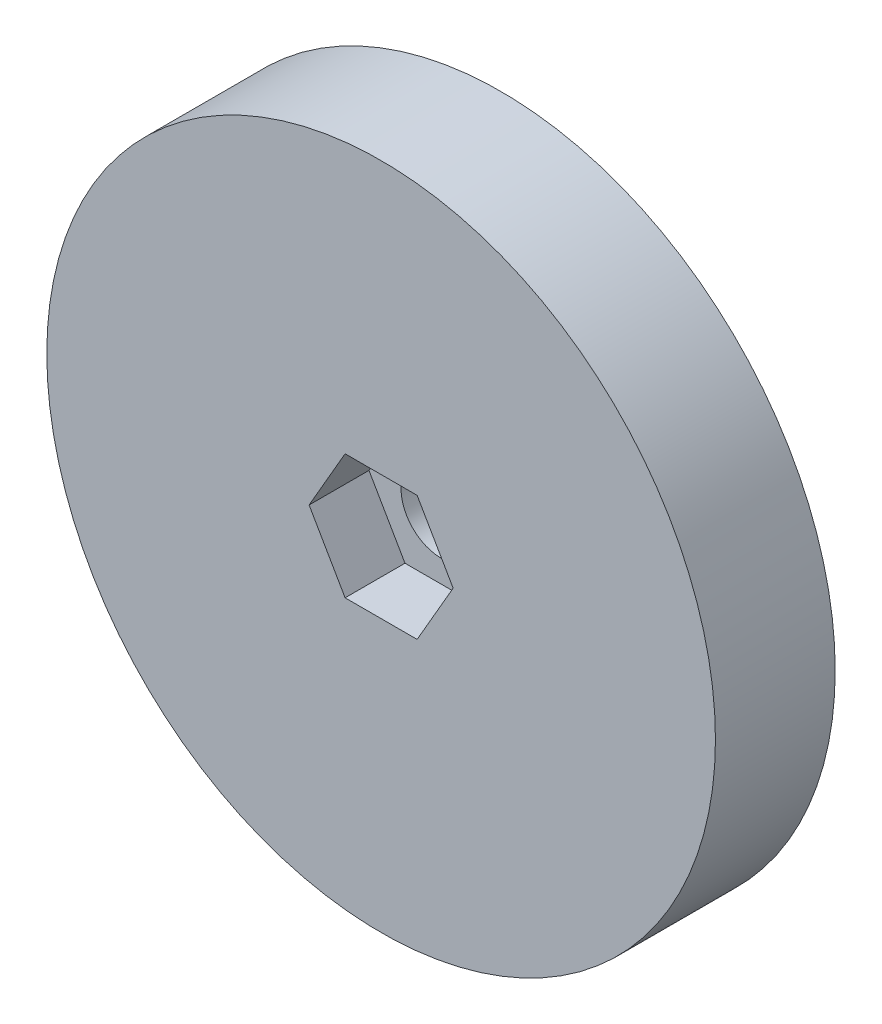
from build123d import *

# Parameters (mm, degrees)
SKETCH1_R           = 33.5
SKETCH1_R_2         = 4
BOSS_EXTRUDE1_DEPTH = 12
CUT_EXTRUDE1_DEPTH  = 6


with BuildPart() as part:
    # Sketch1 → Boss-Extrude1 (new body)
    with BuildSketch(Plane.XY):
        Circle(SKETCH1_R)
        Circle(SKETCH1_R_2, mode=Mode.SUBTRACT)
    extrude(amount=BOSS_EXTRUDE1_DEPTH)

    # Sketch2 → Cut-Extrude1 (cut)
    with BuildSketch(Plane.XY.offset(12)):
        Polygon((7.216878365, 0), (3.608439182, 6.25), (-3.608439182, 6.25), (-7.216878365, 0), (-3.608439182, -6.25), (3.608439182, -6.25), align=None)
    extrude(amount=-CUT_EXTRUDE1_DEPTH, mode=Mode.SUBTRACT)


solid = part.part
